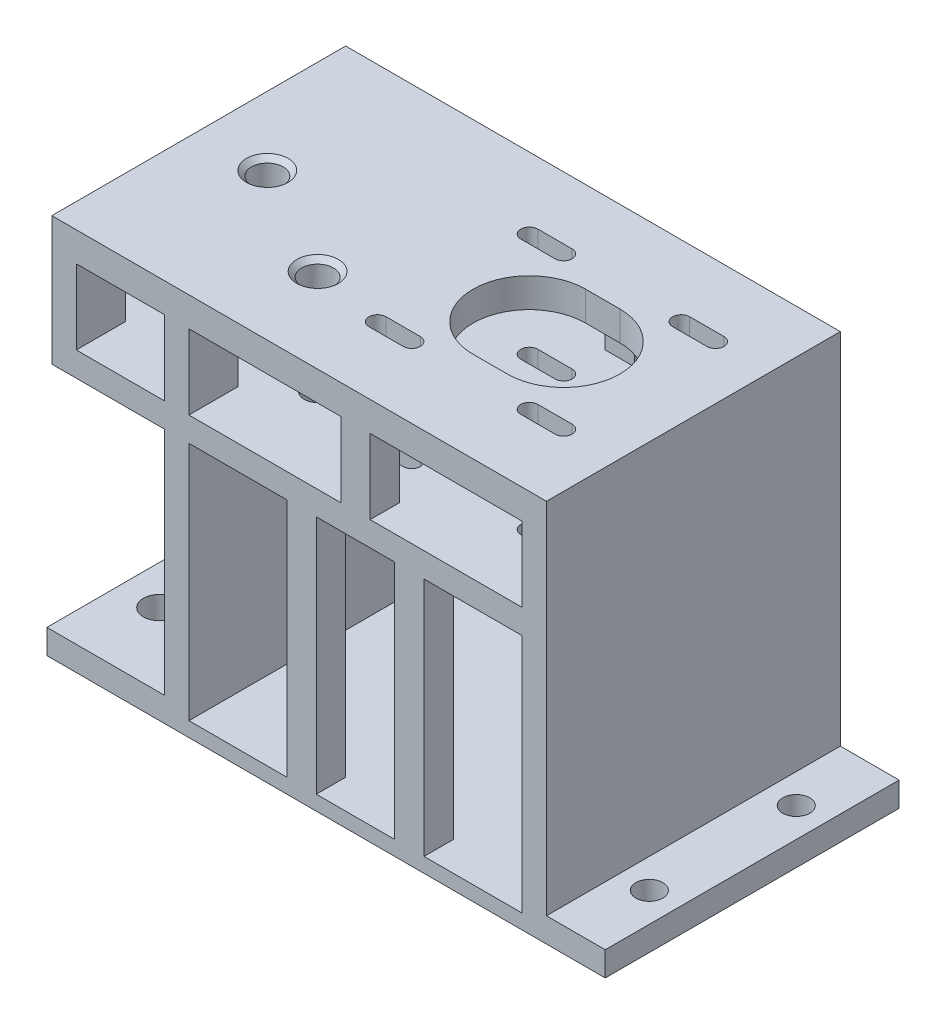
from build123d import *

# Parameters (mm, degrees)
SKETCH1_W           = 68
SKETCH1_H           = 49.05
SKETCH1_H_2         = 15.25
SKETCH1_W_2         = 18
BOSS_EXTRUDE1_DEPTH = 60
SKETCH2_W           = 40
SKETCH2_H           = 15.25
CUT_EXTRUDE1_DEPTH  = 131.214784107
CUT_EXTRUDE2_REACH  = 132.215
CUT_EXTRUDE3_REACH  = 132.215
SKETCH5_R           = 3.25
CUT_EXTRUDE4_REACH  = 120.658
SKETCH6_R           = 2.75
SKETCH7_R           = 2.75
CUT_EXTRUDE5_DEPTH  = 131.214784107
CUT_EXTRUDE6_REACH  = 132.215
SKETCH8_R           = 3.25
CHAMFER1_SIZE       = 1
CUT_EXTRUDE8_REACH  = 132.215
SKETCH10_R          = 3.3
SKETCH10_R_2        = 2.75
SKETCH11_W          = 18.5
SKETCH11_H          = 16
BOSS_EXTRUDE2_DEPTH = 12
SKETCH12_R          = 3.25
CUT_EXTRUDE9_DEPTH  = 119.966970206
CHAMFER2_SIZE       = 1
SKETCH13_W          = 6
SKETCH13_H          = 15.25
BOSS_EXTRUDE3_DEPTH = 6
SKETCH14_W          = 6
SKETCH14_H          = 49.05
BOSS_EXTRUDE4_DEPTH = 6
SKETCH15_W          = 6
SKETCH15_H          = 49.05
SKETCH15_H_2        = 15.25
BOSS_EXTRUDE5_DEPTH = 6
BOSS_EXTRUDE6_DEPTH = 10


with BuildPart() as part:
    # Sketch1 → Boss-Extrude1 (new body)
    with BuildSketch(Plane.XY):
        Polygon((85, 0), (-29, 0), (-29, 5), (-5, 5), (-5, 52.05), (-28, 52.05), (-28, 78.3), (73, 78.3), (73, 5), (85, 5), align=None)
        with Locations((34, 27.525)):
            Rectangle(SKETCH1_W, SKETCH1_H, mode=Mode.SUBTRACT)
        with Locations((34, 64.675)):
            Rectangle(SKETCH1_W, SKETCH1_H_2, mode=Mode.SUBTRACT)
        with Locations((-14, 64.675)):
            Rectangle(SKETCH1_W_2, SKETCH1_H_2, mode=Mode.SUBTRACT)
    extrude(amount=BOSS_EXTRUDE1_DEPTH)

    # Sketch2 → Cut-Extrude1 (cut, through all)
    with BuildSketch(Plane(origin=(0, 0, 0), x_dir=(0, 0, -1), z_dir=(1, 0, 0))):
        with Locations((-30, 64.675)):
            Rectangle(SKETCH2_W, SKETCH2_H)
    extrude(amount=-CUT_EXTRUDE1_DEPTH, mode=Mode.SUBTRACT)

    # Cut-Extrude2: up to this face of the body (flat: up to its plane)
    cut_extrude2_end = Plane(part.part.faces().sort_by_distance((34, 52.05, 30))[0])
    # Sketch3 → Cut-Extrude2 (cut, up to the picked face)
    with BuildSketch(Plane(origin=(0, 78.3, 0), x_dir=(1, 0, 0), z_dir=(0, 1, 0)), mode=Mode.PRIVATE) as cut_extrude2_sk1:
        with BuildLine():
            Line((39.5, -18.5), (46.5, -18.5))
            ThreePointArc((46.5, -18.5), (58, -30), (46.5, -41.5))
            Line((46.5, -41.5), (39.5, -41.5))
            ThreePointArc((39.5, -41.5), (28, -30), (39.5, -18.5))
        make_face()
    cut_extrude2_tool1 = split(extrude(cut_extrude2_sk1.sketch, amount=-CUT_EXTRUDE2_REACH, mode=Mode.PRIVATE), bisect_by=cut_extrude2_end, keep=Keep.BOTH, mode=Mode.PRIVATE)
    # Sketch3 → Cut-Extrude2 (cut, up to the picked face)
    with BuildSketch(Plane(origin=(0, 78.3, 0), x_dir=(1, 0, 0), z_dir=(0, 1, 0)), mode=Mode.PRIVATE) as cut_extrude2_sk2:
        with BuildLine():
            Line((31, -16.25), (24, -16.25))
            ThreePointArc((24, -16.25), (22.25, -14.5), (24, -12.75))
            Line((24, -12.75), (31, -12.75))
            ThreePointArc((31, -12.75), (32.75, -14.5), (31, -16.25))
        make_face()
    cut_extrude2_tool2 = split(extrude(cut_extrude2_sk2.sketch, amount=-CUT_EXTRUDE2_REACH, mode=Mode.PRIVATE), bisect_by=cut_extrude2_end, keep=Keep.BOTH, mode=Mode.PRIVATE)
    # Sketch3 → Cut-Extrude2 (cut, up to the picked face)
    with BuildSketch(Plane(origin=(0, 78.3, 0), x_dir=(1, 0, 0), z_dir=(0, 1, 0)), mode=Mode.PRIVATE) as cut_extrude2_sk3:
        with BuildLine():
            Line((55, -16.25), (62, -16.25))
            ThreePointArc((62, -16.25), (63.75, -14.5), (62, -12.75))
            Line((62, -12.75), (55, -12.75))
            ThreePointArc((55, -12.75), (53.25, -14.5), (55, -16.25))
        make_face()
    cut_extrude2_tool3 = split(extrude(cut_extrude2_sk3.sketch, amount=-CUT_EXTRUDE2_REACH, mode=Mode.PRIVATE), bisect_by=cut_extrude2_end, keep=Keep.BOTH, mode=Mode.PRIVATE)
    # Sketch3 → Cut-Extrude2 (cut, up to the picked face)
    with BuildSketch(Plane(origin=(0, 78.3, 0), x_dir=(1, 0, 0), z_dir=(0, 1, 0)), mode=Mode.PRIVATE) as cut_extrude2_sk4:
        with BuildLine():
            Line((31, -43.75), (24, -43.75))
            ThreePointArc((24, -43.75), (22.25, -45.5), (24, -47.25))
            Line((24, -47.25), (31, -47.25))
            ThreePointArc((31, -47.25), (32.75, -45.5), (31, -43.75))
        make_face()
    cut_extrude2_tool4 = split(extrude(cut_extrude2_sk4.sketch, amount=-CUT_EXTRUDE2_REACH, mode=Mode.PRIVATE), bisect_by=cut_extrude2_end, keep=Keep.BOTH, mode=Mode.PRIVATE)
    # Sketch3 → Cut-Extrude2 (cut, up to the picked face)
    with BuildSketch(Plane(origin=(0, 78.3, 0), x_dir=(1, 0, 0), z_dir=(0, 1, 0)), mode=Mode.PRIVATE) as cut_extrude2_sk5:
        with BuildLine():
            Line((55, -43.75), (62, -43.75))
            ThreePointArc((62, -43.75), (63.75, -45.5), (62, -47.25))
            Line((62, -47.25), (55, -47.25))
            ThreePointArc((55, -47.25), (53.25, -45.5), (55, -43.75))
        make_face()
    cut_extrude2_tool5 = split(extrude(cut_extrude2_sk5.sketch, amount=-CUT_EXTRUDE2_REACH, mode=Mode.PRIVATE), bisect_by=cut_extrude2_end, keep=Keep.BOTH, mode=Mode.PRIVATE)
    add(cut_extrude2_tool1.solids().sort_by(Axis((43, 78.3, 30), (0, -1, 0)))[0], mode=Mode.SUBTRACT)
    add(cut_extrude2_tool2.solids().sort_by(Axis((27.5, 78.3, 14.5), (0, -1, 0)))[0], mode=Mode.SUBTRACT)
    add(cut_extrude2_tool3.solids().sort_by(Axis((58.5, 78.3, 14.5), (0, -1, 0)))[0], mode=Mode.SUBTRACT)
    add(cut_extrude2_tool4.solids().sort_by(Axis((27.5, 78.3, 45.5), (0, -1, 0)))[0], mode=Mode.SUBTRACT)
    add(cut_extrude2_tool5.solids().sort_by(Axis((58.5, 78.3, 45.5), (0, -1, 0)))[0], mode=Mode.SUBTRACT)

    # Sketch5 → Cut-Extrude3 (cut, up to next)
    with BuildSketch(Plane(origin=(0, 78.3, 0), x_dir=(1, 0, 0), z_dir=(0, 1, 0)), mode=Mode.PRIVATE) as cut_extrude3_sk1:
        with Locations(Location((9, -42.73, 0), (0, 0, 270))):
            Circle(SKETCH5_R)
    cut_extrude3_tool1 = extrude(cut_extrude3_sk1.sketch, amount=-CUT_EXTRUDE3_REACH, mode=Mode.PRIVATE) & part.part
    add(cut_extrude3_tool1.solids().sort_by_distance((9, 78.3, 42.73))[0], mode=Mode.SUBTRACT)

    # Sketch6 → Cut-Extrude4 (cut, up to next)
    with BuildSketch(Plane(origin=(0, 57.05, 0), x_dir=(1, 0, 0), z_dir=(0, 1, 0)), mode=Mode.PRIVATE) as cut_extrude4_sk1:
        with Locations(Location((9, -42.73, 0), (0, 0, 270))):
            Circle(SKETCH6_R)
    cut_extrude4_tool1 = extrude(cut_extrude4_sk1.sketch, amount=-CUT_EXTRUDE4_REACH, mode=Mode.PRIVATE) & part.part
    add(cut_extrude4_tool1.solids().sort_by_distance((9, 57.05, 42.73))[0], mode=Mode.SUBTRACT)

    # Sketch7 → Cut-Extrude5 (cut, through all)
    with BuildSketch(Plane(origin=(0, 78.3, 0), x_dir=(1, 0, 0), z_dir=(0, 1, 0))):
        with Locations(Location((-14, -30, 0), (0, 0, 270))):
            Circle(SKETCH7_R)
    extrude(amount=-CUT_EXTRUDE5_DEPTH, mode=Mode.SUBTRACT)

    # Sketch8 → Cut-Extrude6 (cut, up to next)
    with BuildSketch(Plane(origin=(0, 78.3, 0), x_dir=(1, 0, 0), z_dir=(0, 1, 0)), mode=Mode.PRIVATE) as cut_extrude6_sk1:
        with Locations(Location((-14, -30, 0), (0, 0, 270))):
            Circle(SKETCH8_R)
    cut_extrude6_tool1 = extrude(cut_extrude6_sk1.sketch, amount=-CUT_EXTRUDE6_REACH, mode=Mode.PRIVATE) & part.part
    add(cut_extrude6_tool1.solids().sort_by_distance((-14, 78.3, 30))[0], mode=Mode.SUBTRACT)

    # Chamfer1
    chamfer1_edges = [part.edges().sort_by_distance(p)[0] for p in [
        (9, 78.3, 39.48),
        (-14, 78.3, 26.75),
    ]]
    chamfer(chamfer1_edges, length=CHAMFER1_SIZE)

    # Sketch10 → Cut-Extrude8 (cut, up to next)
    with BuildSketch(Plane.XZ, mode=Mode.PRIVATE) as cut_extrude8_sk1:
        with Locations((-21, 45)):
            Circle(SKETCH10_R)
    cut_extrude8_tool1 = extrude(cut_extrude8_sk1.sketch, amount=-CUT_EXTRUDE8_REACH, mode=Mode.PRIVATE) & part.part
    # Sketch10 → Cut-Extrude8 (cut, up to next)
    with BuildSketch(Plane.XZ, mode=Mode.PRIVATE) as cut_extrude8_sk2:
        with Locations((-21, 15)):
            Circle(SKETCH10_R)
    cut_extrude8_tool2 = extrude(cut_extrude8_sk2.sketch, amount=-CUT_EXTRUDE8_REACH, mode=Mode.PRIVATE) & part.part
    # Sketch10 → Cut-Extrude8 (cut, up to next)
    with BuildSketch(Plane.XZ, mode=Mode.PRIVATE) as cut_extrude8_sk3:
        with Locations((79, 15)):
            Circle(SKETCH10_R_2)
    cut_extrude8_tool3 = extrude(cut_extrude8_sk3.sketch, amount=-CUT_EXTRUDE8_REACH, mode=Mode.PRIVATE) & part.part
    # Sketch10 → Cut-Extrude8 (cut, up to next)
    with BuildSketch(Plane.XZ, mode=Mode.PRIVATE) as cut_extrude8_sk4:
        with Locations((79, 45)):
            Circle(SKETCH10_R_2)
    cut_extrude8_tool4 = extrude(cut_extrude8_sk4.sketch, amount=-CUT_EXTRUDE8_REACH, mode=Mode.PRIVATE) & part.part
    add(cut_extrude8_tool1.solids().sort_by_distance((-21, 0, 45))[0], mode=Mode.SUBTRACT)
    add(cut_extrude8_tool2.solids().sort_by_distance((-21, 0, 15))[0], mode=Mode.SUBTRACT)
    add(cut_extrude8_tool3.solids().sort_by_distance((79, 0, 15))[0], mode=Mode.SUBTRACT)
    add(cut_extrude8_tool4.solids().sort_by_distance((79, 0, 45))[0], mode=Mode.SUBTRACT)

    # Sketch11 → Boss-Extrude2 (add)
    with BuildSketch(Plane.XZ.offset(-52.05)):
        with Locations((9.25, 30)):
            Rectangle(SKETCH11_W, SKETCH11_H)
    extrude(amount=BOSS_EXTRUDE2_DEPTH)

    # Sketch12 → Cut-Extrude9 (cut, through all)
    with BuildSketch(Plane(origin=(18.5, 0, 0), x_dir=(0, 0, -1), z_dir=(1, 0, 0))):
        with Locations((-29.33403853, 46.549471103)):
            Circle(SKETCH12_R)
    extrude(amount=-CUT_EXTRUDE9_DEPTH, mode=Mode.SUBTRACT)

    # Chamfer2
    chamfer2_edges = [part.edges().sort_by_distance(p)[0] for p in [
        (-5, 46.549471103, 32.58403853),
    ]]
    chamfer(chamfer2_edges, length=CHAMFER2_SIZE)

    # Sketch13 → Boss-Extrude3 (add)
    with BuildSketch(Plane.XY.offset(60)):
        with Locations((34, 64.675)):
            Rectangle(SKETCH13_W, SKETCH13_H)
    extrude(amount=-BOSS_EXTRUDE3_DEPTH)

    # Sketch14 → Boss-Extrude4 (add)
    with BuildSketch(Plane.XY.offset(60)):
        with Locations((23, 27.525)):
            Rectangle(SKETCH14_W, SKETCH14_H)
        with Locations((45, 27.525)):
            Rectangle(SKETCH14_W, SKETCH14_H)
    extrude(amount=-BOSS_EXTRUDE4_DEPTH)

    # Sketch15 → Boss-Extrude5 (add)
    with BuildSketch(Plane(origin=(0, 0, 0), x_dir=(-1, 0, 0), z_dir=(0, 0, -1))):
        with Locations((-23, 27.525)):
            Rectangle(SKETCH15_W, SKETCH15_H)
        with Locations((-34, 64.675)):
            Rectangle(SKETCH15_W, SKETCH15_H_2)
    extrude(amount=-BOSS_EXTRUDE5_DEPTH)

    # Sketch16 → Boss-Extrude6 (add)
    with BuildSketch(Plane(origin=(0, 0, 0), x_dir=(-1, 0, 0), z_dir=(0, 0, -1))):
        Polygon((28, 52.05), (5, 29.05), (5, 52.05), align=None)
    extrude(amount=-BOSS_EXTRUDE6_DEPTH)


solid = part.part
